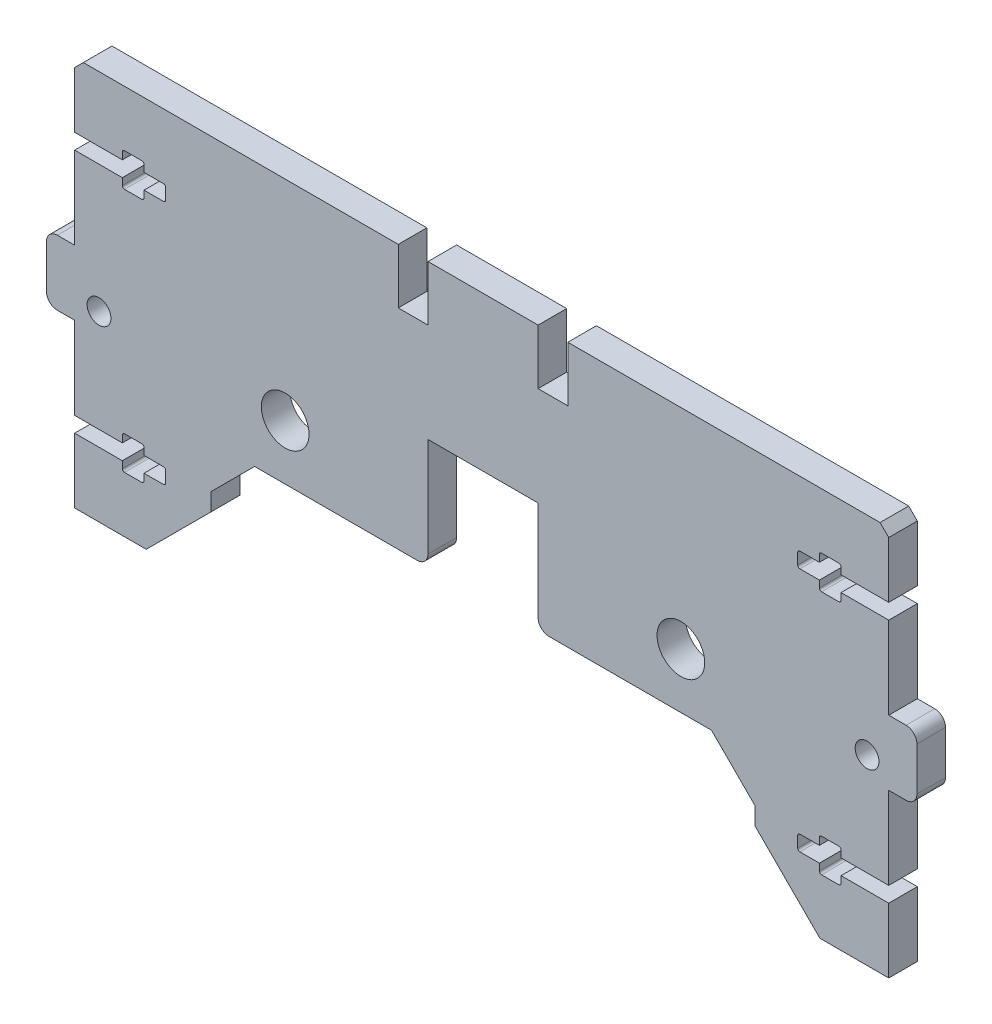
from build123d import *

# Parameters (mm, degrees)
MODEL_R             = 5.5
MODEL_R_2           = 2.75
BOSS_EXTRUDE1_DEPTH = 6.6


with BuildPart() as part:
    # Model → Boss-Extrude1 (new body)
    with BuildSketch(Plane.XY):
        with BuildLine():
            Line((146.910001664, 29.054806781), (156.910001664, 19.054806781))
            Line((156.910001664, 19.054806781), (156.910001664, 15))
            Line((156.910001664, 15), (171.910001664, 0))
            Line((171.910001664, 0), (187.8, 0))
            Line((187.8, 0), (187.8, 14.95))
            Line((187.8, 14.95), (176.8, 14.95))
            Line((176.8, 14.95), (176.8, 13.365))
            ThreePointArc((176.8, 13.365), (176.653553391, 13.011446609), (176.3, 12.865))
            Line((176.3, 12.865), (172.3, 12.865))
            ThreePointArc((172.3, 12.865), (171.946446609, 13.011446609), (171.8, 13.365))
            Line((171.8, 13.365), (171.8, 14.95))
            Line((171.8, 14.95), (167.3, 14.95))
            ThreePointArc((167.3, 14.95), (166.946446609, 15.096446609), (166.8, 15.45))
            Line((166.8, 15.45), (166.8, 18))
            ThreePointArc((166.8, 18), (166.946446609, 18.353553391), (167.3, 18.5))
            Line((167.3, 18.5), (171.8, 18.5))
            Line((171.8, 18.5), (171.8, 20.085))
            ThreePointArc((171.8, 20.085), (171.946446609, 20.438553391), (172.3, 20.585))
            Line((172.3, 20.585), (176.3, 20.585))
            ThreePointArc((176.3, 20.585), (176.653553391, 20.438553391), (176.8, 20.085))
            Line((176.8, 20.085), (176.8, 18.5))
            Line((176.8, 18.5), (187.8, 18.5))
            Line((187.8, 18.5), (187.8, 37.5))
            Line((187.8, 37.5), (191.8, 37.5))
            ThreePointArc((191.8, 37.5), (193.567766953, 38.232233047), (194.3, 40))
            Line((194.3, 40), (194.3, 50))
            ThreePointArc((194.3, 50), (193.567766953, 51.767766953), (191.8, 52.5))
            Line((191.8, 52.5), (187.8, 52.5))
            Line((187.8, 52.5), (187.8, 71.5))
            Line((187.8, 71.5), (176.8, 71.5))
            Line((176.8, 71.5), (176.8, 69.915))
            ThreePointArc((176.8, 69.915), (176.653553391, 69.561446609), (176.3, 69.415))
            Line((176.3, 69.415), (172.3, 69.415))
            ThreePointArc((172.3, 69.415), (171.946446609, 69.561446609), (171.8, 69.915))
            Line((171.8, 69.915), (171.8, 71.5))
            Line((171.8, 71.5), (167.3, 71.5))
            ThreePointArc((167.3, 71.5), (166.946446609, 71.646446609), (166.8, 72))
            Line((166.8, 72), (166.8, 74.55))
            ThreePointArc((166.8, 74.55), (166.946446609, 74.903553391), (167.3, 75.05))
            Line((167.3, 75.05), (171.8, 75.05))
            Line((171.8, 75.05), (171.8, 76.635))
            ThreePointArc((171.8, 76.635), (171.946446609, 76.988553391), (172.3, 77.135))
            Line((172.3, 77.135), (176.3, 77.135))
            ThreePointArc((176.3, 77.135), (176.653553391, 76.988553391), (176.8, 76.635))
            Line((176.8, 76.635), (176.8, 75.05))
            Line((176.8, 75.05), (187.8, 75.05))
            Line((187.8, 75.05), (187.8, 88))
            Line((187.8, 88), (185.8, 90))
            Line((185.8, 90), (113.770001664, 90))
            Line((113.770001664, 90), (113.770001664, 77.3))
            Line((113.770001664, 77.3), (106.910001664, 77.3))
            Line((106.910001664, 77.3), (106.910001664, 90))
            Line((106.910001664, 90), (81.510001665, 90))
            Line((81.510001665, 90), (81.510001665, 77.3))
            Line((81.510001665, 77.3), (74.650001665, 77.3))
            Line((74.650001665, 77.3), (74.650001665, 90))
            Line((74.650001665, 90), (2, 90))
            Line((2, 90), (0, 88))
            Line((0, 88), (0, 75.05))
            Line((0, 75.05), (11, 75.05))
            Line((11, 75.05), (11, 76.635))
            ThreePointArc((11, 76.635), (11.146446609, 76.988553391), (11.5, 77.135))
            Line((11.5, 77.135), (15.5, 77.135))
            ThreePointArc((15.5, 77.135), (15.853553391, 76.988553391), (16, 76.635))
            Line((16, 76.635), (16, 75.05))
            Line((16, 75.05), (20.5, 75.05))
            ThreePointArc((20.5, 75.05), (20.853553391, 74.903553391), (21, 74.55))
            Line((21, 74.55), (21, 72))
            ThreePointArc((21, 72), (20.853553391, 71.646446609), (20.5, 71.5))
            Line((20.5, 71.5), (16, 71.5))
            Line((16, 71.5), (16, 69.915))
            ThreePointArc((16, 69.915), (15.853553391, 69.561446609), (15.5, 69.415))
            Line((15.5, 69.415), (11.5, 69.415))
            ThreePointArc((11.5, 69.415), (11.146446609, 69.561446609), (11, 69.915))
            Line((11, 69.915), (11, 71.5))
            Line((11, 71.5), (0, 71.5))
            Line((0, 71.5), (0, 52.5))
            Line((0, 52.5), (-4, 52.5))
            ThreePointArc((-4, 52.5), (-5.767766953, 51.767766953), (-6.5, 50))
            Line((-6.5, 50), (-6.5, 40))
            ThreePointArc((-6.5, 40), (-5.767766953, 38.232233047), (-4, 37.5))
            Line((-4, 37.5), (0, 37.5))
            Line((0, 37.5), (0, 18.5))
            Line((0, 18.5), (11, 18.5))
            Line((11, 18.5), (11, 20.085))
            ThreePointArc((11, 20.085), (11.146446609, 20.438553391), (11.5, 20.585))
            Line((11.5, 20.585), (15.5, 20.585))
            ThreePointArc((15.5, 20.585), (15.853553391, 20.438553391), (16, 20.085))
            Line((16, 20.085), (16, 18.5))
            Line((16, 18.5), (20.5, 18.5))
            ThreePointArc((20.5, 18.5), (20.853553391, 18.353553391), (21, 18))
            Line((21, 18), (21, 15.45))
            ThreePointArc((21, 15.45), (20.853553391, 15.096446609), (20.5, 14.95))
            Line((20.5, 14.95), (16, 14.95))
            Line((16, 14.95), (16, 13.365))
            ThreePointArc((16, 13.365), (15.853553391, 13.011446609), (15.5, 12.865))
            Line((15.5, 12.865), (11.5, 12.865))
            ThreePointArc((11.5, 12.865), (11.146446609, 13.011446609), (11, 13.365))
            Line((11, 13.365), (11, 14.95))
            Line((11, 14.95), (0, 14.95))
            Line((0, 14.95), (0, 0))
            Line((0, 0), (16.510001665, 0))
            Line((16.510001665, 0), (31.510001665, 15))
            Line((31.510001665, 15), (31.510001665, 19.054806781))
            Line((31.510001665, 19.054806781), (41.510001665, 29.054806781))
            Line((41.510001665, 29.054806781), (79.010001665, 29.054806781))
            ThreePointArc((79.010001665, 29.054806781), (80.777768618, 29.787039828), (81.510001665, 31.554806781))
            Line((81.510001665, 31.554806781), (81.510001665, 54.45480678))
            Line((81.510001665, 54.45480678), (106.910001664, 54.45480678))
            Line((106.910001664, 54.45480678), (106.910001664, 31.554806781))
            ThreePointArc((106.910001664, 31.554806781), (107.642234711, 29.787039828), (109.410001664, 29.054806781))
            Line((109.410001664, 29.054806781), (146.910001664, 29.054806781))
        make_face()
        with Locations((139.852001664, 41.754806781)):
            Circle(MODEL_R, mode=Mode.SUBTRACT)
        with Locations((48.568001665, 41.754806781)):
            Circle(MODEL_R, mode=Mode.SUBTRACT)
        with Locations((182.8, 42.08)):
            Circle(MODEL_R_2, mode=Mode.SUBTRACT)
        with Locations((5.62000333, 42.08)):
            Circle(MODEL_R_2, mode=Mode.SUBTRACT)
    extrude(amount=BOSS_EXTRUDE1_DEPTH)


solid = part.part
